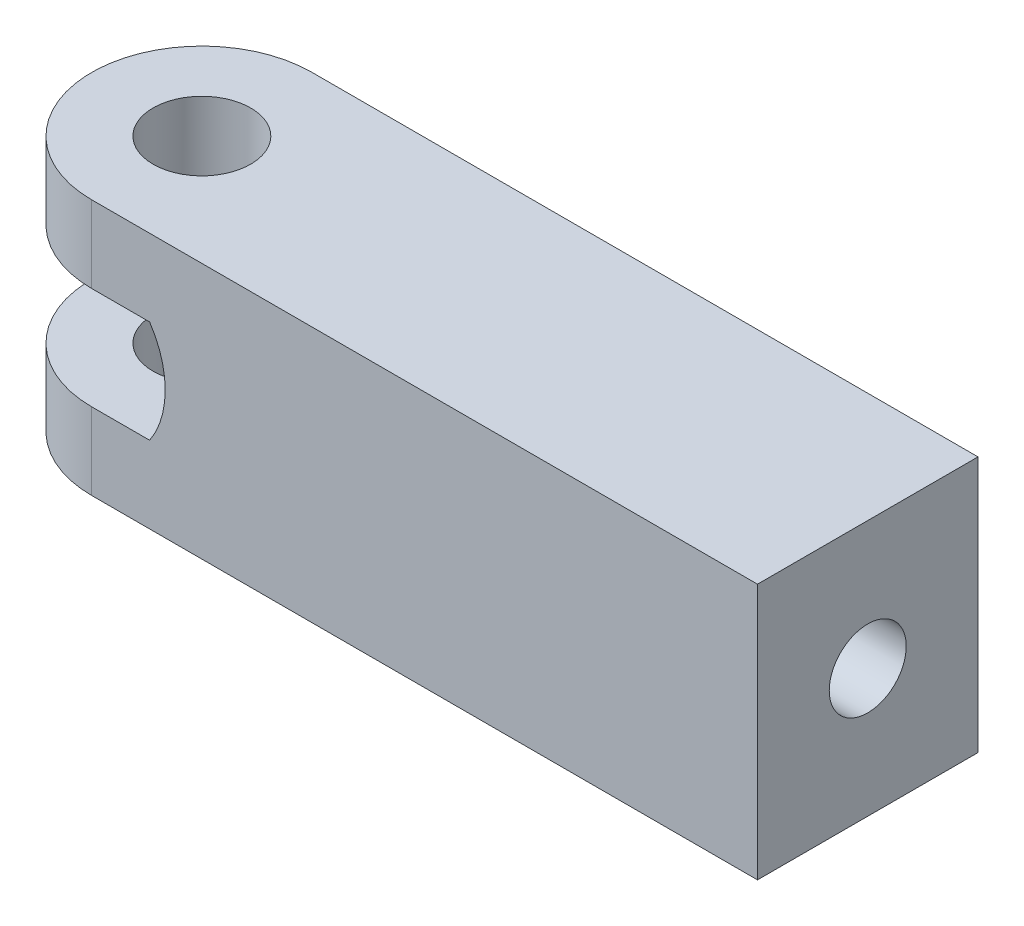
from build123d import *

# Parameters (mm, degrees)
SKETCH2_W               = 30
SKETCH2_H               = 30
BOSS_EXTRUDE3_DEPTH     = 12.5
CUT_EXTRUDE1_DEPTH      = 25.622144504
CUT_EXTRUDE1_DEPTH_BACK = 25.622144504
SKETCH1_R               = 4.7625
CUT_EXTRUDE2_DEPTH      = 30.061583319
CUT_EXTRUDE2_DEPTH_BACK = 30.061583319
SKETCH3_W               = 10.7625
SKETCH3_H               = 10
SKETCH5_W               = 21.525
SKETCH5_H               = 25
BOSS_EXTRUDE4_DEPTH     = 50
CUT_EXTRUDE3_DEPTH      = 78.537331734
CUT_EXTRUDE3_DEPTH_BACK = 10
SKETCH6_R               = 3.7592


with BuildPart() as part:
    # Sketch2 → Boss-Extrude3 (new, symmetric)
    with BuildSketch(Plane(origin=(0, 0, 0), x_dir=(1, 0, 0), z_dir=(0, 1, 0))):
        Rectangle(SKETCH2_W, SKETCH2_H)
    extrude(amount=BOSS_EXTRUDE3_DEPTH, both=True)

    # Sketch1 → Cut-Extrude1 (cut, two sides: drawn at the far end of the back side and taken through both)
    with BuildSketch(Plane(origin=(0, 0, 0), x_dir=(1, 0, 0), z_dir=(0, 1, 0)).offset(-CUT_EXTRUDE1_DEPTH_BACK)):
        with Locations(Location((0, 0, 0), (0, 0, 270))):
            Circle(SKETCH1_R)
        with BuildLine():
            ThreePointArc((0, -10.7625), (-10.7625, 0), (0, 10.7625))
            Line((0, 10.7625), (15, 10.7625))
            Line((15, 10.7625), (15, 15))
            Line((15, 15), (-15, 15))
            Line((-15, 15), (-15, -15))
            Line((-15, -15), (15, -15))
            Line((15, -15), (15, -10.7625))
            Line((15, -10.7625), (0, -10.7625))
        make_face()
    extrude(amount=CUT_EXTRUDE1_DEPTH + CUT_EXTRUDE1_DEPTH_BACK, mode=Mode.SUBTRACT)

    # Sketch3 → Cut-Extrude2 (cut, two sides: drawn at the far end of the back side and taken through both)
    with BuildSketch(Plane.XY.offset(10.7625).offset(-CUT_EXTRUDE2_DEPTH_BACK)):
        with BuildLine():
            Line((0, -5), (5.665118464, -5))
            ThreePointArc((5.665118464, -5), (7.186330553, 0), (5.665118464, 5))
            Line((5.665118464, 5), (0, 5))
            Line((0, 5), (0, -5))
        make_face()
        with Locations((-5.38125, 0)):
            Rectangle(SKETCH3_W, SKETCH3_H)
    extrude(amount=CUT_EXTRUDE2_DEPTH + CUT_EXTRUDE2_DEPTH_BACK, mode=Mode.SUBTRACT)

    # Sketch5 → Boss-Extrude4 (add)
    with BuildSketch(Plane(origin=(15, 0, 0), x_dir=(0, 0, -1), z_dir=(1, 0, 0))):
        Rectangle(SKETCH5_W, SKETCH5_H)
    extrude(amount=BOSS_EXTRUDE4_DEPTH)

    # Sketch6 → Cut-Extrude3 (cut, two sides: drawn at the far end of the back side and taken through both)
    with BuildSketch(Plane(origin=(65, 0, 0), x_dir=(0, 0, -1), z_dir=(1, 0, 0)).offset(-CUT_EXTRUDE3_DEPTH_BACK)):
        with Locations(Location((0, 0, 0), (0, 0, 180))):
            Circle(SKETCH6_R)
    extrude(amount=CUT_EXTRUDE3_DEPTH + CUT_EXTRUDE3_DEPTH_BACK, mode=Mode.SUBTRACT)


solid = part.part
